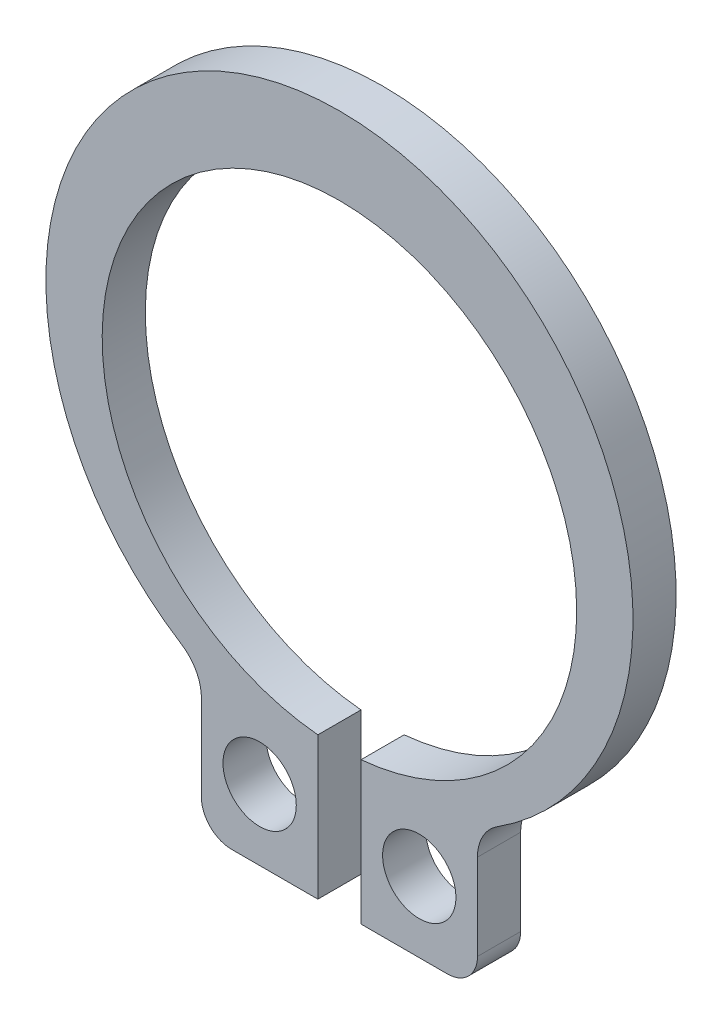
from build123d import *

# Parameters (mm, degrees)
BODYSKE_R      = 0.85
BASEBODY_DEPTH = 1
FILLET1_R      = 1
FILLET2_R      = 0.7


with BuildPart() as part:
    # BodySke → BaseBody (new body)
    with BuildSketch(Plane.XY):
        with BuildLine():
            Line((-0.5, -5.477225575), (-0.5, -8.777225575))
            Line((-0.5, -8.777225575), (-3.2, -8.777225575))
            Line((-3.2, -8.777225575), (-3.2, -5.510666075))
            ThreePointArc((-3.2, -5.510666075), (0, 7.3), (3.2, -5.510666075))
            Line((3.2, -5.510666075), (3.2, -8.777225575))
            Line((3.2, -8.777225575), (0.5, -8.777225575))
            Line((0.5, -8.777225575), (0.5, -5.477225575))
            ThreePointArc((0.5, -5.477225575), (0, 5.5), (-0.5, -5.477225575))
        make_face()
        with Locations((-1.85, -7.143945825)):
            Circle(BODYSKE_R, mode=Mode.SUBTRACT)
        with Locations(Location((1.85, -7.143945825, 0), (0, 0, 180))):
            Circle(BODYSKE_R, mode=Mode.SUBTRACT)
    extrude(amount=BASEBODY_DEPTH)

    # Fillet1
    fillet1_edges = [part.edges().sort_by_distance(p)[0] for p in [
        (-3.2, -5.510666075, 0.5),
        (3.2, -5.510666075, 0.5),
    ]]
    fillet(fillet1_edges, radius=FILLET1_R)

    # Fillet2
    fillet2_edges = [part.edges().sort_by_distance(p)[0] for p in [
        (-3.2, -8.777225575, 0.5),
        (3.2, -8.777225575, 0.5),
    ]]
    fillet(fillet2_edges, radius=FILLET2_R)


solid = part.part
